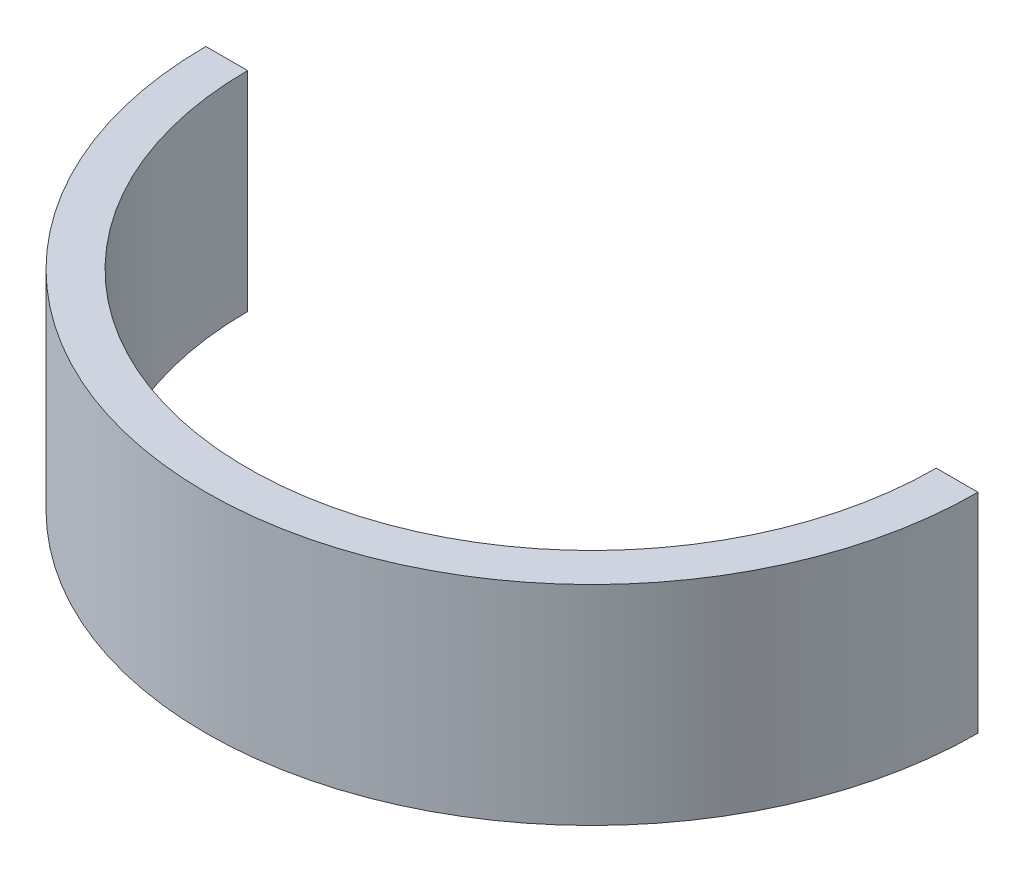
from build123d import *

# Parameters (mm, degrees)
EXTRUDE_1_DEPTH = 40


with BuildPart() as part:
    # 草图1 → 凸台-拉伸1 (new body)
    with BuildSketch(Plane(origin=(0, 0, 0), x_dir=(1, 0, 0), z_dir=(0, 1, 0))):
        with BuildLine():
            Line((-74, 0), (-66, 0))
            ThreePointArc((-66, 0), (0, -66), (66, 0))
            Line((66, 0), (74, 0))
            ThreePointArc((74, 0), (0, -74), (-74, 0))
        make_face()
    extrude(amount=EXTRUDE_1_DEPTH)


solid = part.part
